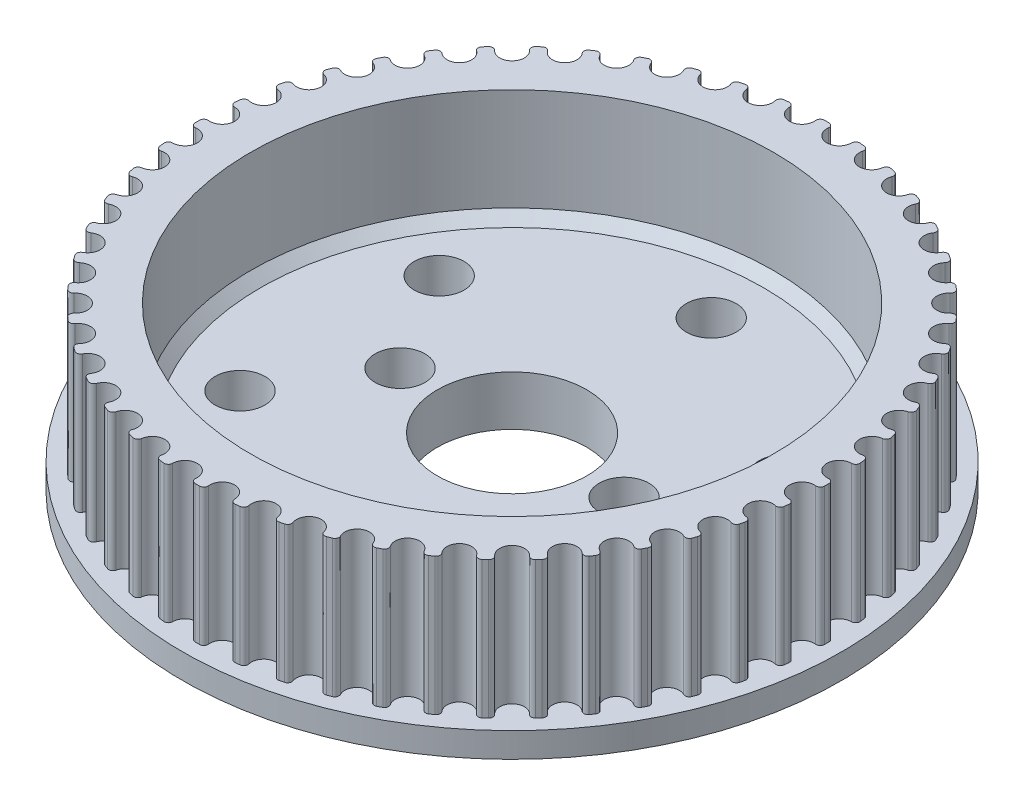
from build123d import *

# Parameters (mm, degrees)
BOSS_EXTRUDE1_DEPTH = 17.500000052
SKETCH2_R           = 33.3375
CUT_EXTRUDE1_DEPTH  = 60.384305584
SKETCH2_3_R         = 42.031336413
SKETCH2_3_R_2       = 9.525
BOSS_EXTRUDE2_DEPTH = 3.175
SKETCH2_4_R         = 33.3375
SKETCH2_4_R_2       = 9.525
BOSS_EXTRUDE3_DEPTH = 3.175
SKETCH3_R           = 3.175
CUT_EXTRUDE2_DEPTH  = 63.934268157
CHAMFER1_SIZE       = 1.27


with BuildPart() as part:
    # Sketch1 → Boss-Extrude1 (new body)
    with BuildSketch(Plane(origin=(0, 0, 0), x_dir=(1, 0, 0), z_dir=(0, 1, 0))):
        with BuildLine():
            ThreePointArc((39.528983097, 0.816020713), (37.771298771, 2.284742655), (39.339132732, 3.954621394))
            ThreePointArc((39.339132732, 3.954621394), (39.736181573, 4.133385986), (39.867708482, 4.548482641))
            ThreePointArc((39.867708482, 4.548482641), (39.850999917, 4.692619693), (39.833770242, 4.836695382))
            ThreePointArc((39.833770242, 4.836695382), (39.816019684, 4.980707824), (39.797748475, 5.124655137))
            ThreePointArc((39.797748475, 5.124655137), (39.570704367, 5.496213388), (39.142411877, 5.574763399))
            ThreePointArc((39.142411877, 5.574763399), (37.220508181, 6.820911271), (38.575629228, 8.667596215))
            ThreePointArc((38.575629228, 8.667596215), (38.948235445, 8.892916361), (39.028769002, 9.320840311))
            ThreePointArc((39.028769002, 9.320840311), (38.994808459, 9.461912447), (38.960338004, 9.602860854))
            ThreePointArc((38.960338004, 9.602860854), (38.925358085, 9.74368369), (38.889869162, 9.884379114))
            ThreePointArc((38.889869162, 9.884379114), (38.619694063, 10.225861144), (38.18505615, 10.252213482))
            ThreePointArc((38.18505615, 10.252213482), (36.126958769, 11.257615642), (37.249606185, 13.254177965))
            ThreePointArc((37.249606185, 13.254177965), (37.592336341, 13.52276799), (37.620702185, 13.957279141))
            ThreePointArc((37.620702185, 13.957279141), (37.569984886, 14.093229211), (37.518776306, 14.228994991))
            ThreePointArc((37.518776306, 14.228994991), (37.467077113, 14.364574707), (37.414887985, 14.499966586))
            ThreePointArc((37.414887985, 14.499966586), (37.105521656, 14.806392818), (36.67087632, 14.780163207))
            ThreePointArc((36.67087632, 14.780163207), (34.506596947, 15.530158627), (35.380400005, 17.647483956))
            ThreePointArc((35.380400005, 17.647483956), (35.688256322, 17.955427212), (35.664040816, 18.390189412))
            ThreePointArc((35.664040816, 18.390189412), (35.597306333, 18.519034958), (35.530106364, 18.64763834))
            ThreePointArc((35.530106364, 18.64763834), (35.462441788, 18.775997879), (35.39431349, 18.904111894))
            ThreePointArc((35.39431349, 18.904111894), (35.05026719, 19.171013943), (34.621952537, 19.09258487))
            ThreePointArc((34.621952537, 19.09258487), (32.38305124, 19.576236928), (32.995267924, 21.783449891))
            ThreePointArc((32.995267924, 21.783449891), (33.263761163, 22.126255873), (33.187317423, 22.55492931))
            ThreePointArc((33.187317423, 22.55492931), (33.105538896, 22.674791473), (33.023327465, 22.794357132))
            ThreePointArc((33.023327465, 22.794357132), (32.940684208, 22.913624721), (32.857610203, 23.032592682))
            ThreePointArc((32.857610203, 23.032592682), (32.483900901, 23.256078516), (32.068162725, 23.126593652))
            ThreePointArc((32.068162725, 23.126593652), (29.787287725, 23.336849613), (30.128990537, 25.601764075))
            ThreePointArc((30.128990537, 25.601764075), (30.354205463, 25.974433899), (30.226648211, 26.390767549))
            ThreePointArc((30.226648211, 26.390767549), (30.131018154, 26.499898471), (30.03499409, 26.608682868))
            ThreePointArc((30.03499409, 26.608682868), (29.938577275, 26.717119318), (29.841768971, 26.825206404))
            ThreePointArc((29.841768971, 26.825206404), (29.443846189, 27.002017096), (29.046746888, 26.823364623))
            ThreePointArc((29.046746888, 26.823364623), (26.75715848, 26.75715848), (26.823364623, 29.046746888))
            ThreePointArc((26.823364623, 29.046746888), (27.002017096, 29.443846189), (26.825206404, 29.841768971))
            ThreePointArc((26.825206404, 29.841768971), (26.717119318, 29.938577275), (26.608682868, 30.03499409))
            ThreePointArc((26.608682868, 30.03499409), (26.499898471, 30.131018154), (26.390767549, 30.226648211))
            ThreePointArc((26.390767549, 30.226648211), (25.974433899, 30.354205463), (25.601764075, 30.128990537))
            ThreePointArc((25.601764075, 30.128990537), (23.336849613, 29.787287725), (23.126593652, 32.068162725))
            ThreePointArc((23.126593652, 32.068162725), (23.256078516, 32.483900901), (23.032592682, 32.857610203))
            ThreePointArc((23.032592682, 32.857610203), (22.913624721, 32.940684208), (22.794357132, 33.023327465))
            ThreePointArc((22.794357132, 33.023327465), (22.674791473, 33.105538896), (22.55492931, 33.187317423))
            ThreePointArc((22.55492931, 33.187317423), (22.126255873, 33.263761163), (21.783449891, 32.995267924))
            ThreePointArc((21.783449891, 32.995267924), (19.576236928, 32.38305124), (19.09258487, 34.621952537))
            ThreePointArc((19.09258487, 34.621952537), (19.171013943, 35.05026719), (18.904111894, 35.39431349))
            ThreePointArc((18.904111894, 35.39431349), (18.775997879, 35.462441788), (18.64763834, 35.530106364))
            ThreePointArc((18.64763834, 35.530106364), (18.519034958, 35.597306333), (18.390189412, 35.664040816))
            ThreePointArc((18.390189412, 35.664040816), (17.955427212, 35.688256322), (17.647483956, 35.380400005))
            ThreePointArc((17.647483956, 35.380400005), (15.530158627, 34.506596947), (14.780163207, 36.67087632))
            ThreePointArc((14.780163207, 36.67087632), (14.806392818, 37.105521656), (14.499966586, 37.414887985))
            ThreePointArc((14.499966586, 37.414887985), (14.364574707, 37.467077113), (14.228994991, 37.518776306))
            ThreePointArc((14.228994991, 37.518776306), (14.093229211, 37.569984886), (13.957279141, 37.620702185))
            ThreePointArc((13.957279141, 37.620702185), (13.52276799, 37.592336341), (13.254177965, 37.249606185))
            ThreePointArc((13.254177965, 37.249606185), (11.257615642, 36.126958769), (10.252213482, 38.18505615))
            ThreePointArc((10.252213482, 38.18505615), (10.225861144, 38.619694063), (9.884379114, 38.889869162))
            ThreePointArc((9.884379114, 38.889869162), (9.74368369, 38.925358085), (9.602860854, 38.960338004))
            ThreePointArc((9.602860854, 38.960338004), (9.461912447, 38.994808459), (9.320840311, 39.028769002))
            ThreePointArc((9.320840311, 39.028769002), (8.892916361, 38.948235445), (8.667596215, 38.575629228))
            ThreePointArc((8.667596215, 38.575629228), (6.820911271, 37.220508181), (5.574763399, 39.142411877))
            ThreePointArc((5.574763399, 39.142411877), (5.496213388, 39.570704367), (5.124655137, 39.797748475))
            ThreePointArc((5.124655137, 39.797748475), (4.980707824, 39.816019684), (4.836695382, 39.833770242))
            ThreePointArc((4.836695382, 39.833770242), (4.692619693, 39.850999917), (4.548482641, 39.867708482))
            ThreePointArc((4.548482641, 39.867708482), (4.133385986, 39.736181573), (3.954621394, 39.339132732))
            ThreePointArc((3.954621394, 39.339132732), (2.284742655, 37.771298771), (0.816020713, 39.528983097))
            ThreePointArc((0.816020713, 39.528983097), (0.686418465, 39.944684695), (0.290202148, 40.125286998))
            ThreePointArc((0.290202148, 40.125286998), (0.145102023, 40.126074058), (0, 40.126336413))
            ThreePointArc((0, 40.126336413), (-0.145102023, 40.126074058), (-0.290202148, 40.125286998))
            ThreePointArc((-0.290202148, 40.125286998), (-0.686418465, 39.944684695), (-0.816020713, 39.528983097))
            ThreePointArc((-0.816020713, 39.528983097), (-2.284742655, 37.771298771), (-3.954621394, 39.339132732))
            ThreePointArc((-3.954621394, 39.339132732), (-4.133385986, 39.736181573), (-4.548482641, 39.867708482))
            ThreePointArc((-4.548482641, 39.867708482), (-4.692619693, 39.850999917), (-4.836695382, 39.833770242))
            ThreePointArc((-4.836695382, 39.833770242), (-4.980707824, 39.816019684), (-5.124655137, 39.797748475))
            ThreePointArc((-5.124655137, 39.797748475), (-5.496213388, 39.570704367), (-5.574763399, 39.142411877))
            ThreePointArc((-5.574763399, 39.142411877), (-6.820911271, 37.220508181), (-8.667596215, 38.575629228))
            ThreePointArc((-8.667596215, 38.575629228), (-8.892916361, 38.948235445), (-9.320840311, 39.028769002))
            ThreePointArc((-9.320840311, 39.028769002), (-9.461912447, 38.994808459), (-9.602860854, 38.960338004))
            ThreePointArc((-9.602860854, 38.960338004), (-9.74368369, 38.925358085), (-9.884379114, 38.889869162))
            ThreePointArc((-9.884379114, 38.889869162), (-10.225861144, 38.619694063), (-10.252213482, 38.18505615))
            ThreePointArc((-10.252213482, 38.18505615), (-11.257615642, 36.126958769), (-13.254177965, 37.249606185))
            ThreePointArc((-13.254177965, 37.249606185), (-13.52276799, 37.592336341), (-13.957279141, 37.620702185))
            ThreePointArc((-13.957279141, 37.620702185), (-14.093229211, 37.569984886), (-14.228994991, 37.518776306))
            ThreePointArc((-14.228994991, 37.518776306), (-14.364574707, 37.467077113), (-14.499966586, 37.414887985))
            ThreePointArc((-14.499966586, 37.414887985), (-14.806392818, 37.105521656), (-14.780163207, 36.67087632))
            ThreePointArc((-14.780163207, 36.67087632), (-15.530158627, 34.506596947), (-17.647483956, 35.380400005))
            ThreePointArc((-17.647483956, 35.380400005), (-17.955427212, 35.688256322), (-18.390189412, 35.664040816))
            ThreePointArc((-18.390189412, 35.664040816), (-18.519034958, 35.597306333), (-18.64763834, 35.530106364))
            ThreePointArc((-18.64763834, 35.530106364), (-18.775997879, 35.462441788), (-18.904111894, 35.39431349))
            ThreePointArc((-18.904111894, 35.39431349), (-19.171013943, 35.05026719), (-19.09258487, 34.621952537))
            ThreePointArc((-19.09258487, 34.621952537), (-19.576236928, 32.38305124), (-21.783449891, 32.995267924))
            ThreePointArc((-21.783449891, 32.995267924), (-22.126255873, 33.263761163), (-22.55492931, 33.187317423))
            ThreePointArc((-22.55492931, 33.187317423), (-22.674791473, 33.105538896), (-22.794357132, 33.023327465))
            ThreePointArc((-22.794357132, 33.023327465), (-22.913624721, 32.940684208), (-23.032592682, 32.857610203))
            ThreePointArc((-23.032592682, 32.857610203), (-23.256078516, 32.483900901), (-23.126593652, 32.068162725))
            ThreePointArc((-23.126593652, 32.068162725), (-23.336849613, 29.787287725), (-25.601764075, 30.128990537))
            ThreePointArc((-25.601764075, 30.128990537), (-25.974433899, 30.354205463), (-26.390767549, 30.226648211))
            ThreePointArc((-26.390767549, 30.226648211), (-26.499898471, 30.131018154), (-26.608682868, 30.03499409))
            ThreePointArc((-26.608682868, 30.03499409), (-26.717119318, 29.938577275), (-26.825206404, 29.841768971))
            ThreePointArc((-26.825206404, 29.841768971), (-27.002017096, 29.443846189), (-26.823364623, 29.046746888))
            ThreePointArc((-26.823364623, 29.046746888), (-26.75715848, 26.75715848), (-29.046746888, 26.823364623))
            ThreePointArc((-29.046746888, 26.823364623), (-29.443846189, 27.002017096), (-29.841768971, 26.825206404))
            ThreePointArc((-29.841768971, 26.825206404), (-29.938577275, 26.717119318), (-30.03499409, 26.608682868))
            ThreePointArc((-30.03499409, 26.608682868), (-30.131018154, 26.499898471), (-30.226648211, 26.390767549))
            ThreePointArc((-30.226648211, 26.390767549), (-30.354205463, 25.974433899), (-30.128990537, 25.601764075))
            ThreePointArc((-30.128990537, 25.601764075), (-29.787287725, 23.336849613), (-32.068162725, 23.126593652))
            ThreePointArc((-32.068162725, 23.126593652), (-32.483900901, 23.256078516), (-32.857610203, 23.032592682))
            ThreePointArc((-32.857610203, 23.032592682), (-32.940684208, 22.913624721), (-33.023327465, 22.794357132))
            ThreePointArc((-33.023327465, 22.794357132), (-33.105538896, 22.674791473), (-33.187317423, 22.55492931))
            ThreePointArc((-33.187317423, 22.55492931), (-33.263761163, 22.126255873), (-32.995267924, 21.783449891))
            ThreePointArc((-32.995267924, 21.783449891), (-32.38305124, 19.576236928), (-34.621952537, 19.09258487))
            ThreePointArc((-34.621952537, 19.09258487), (-35.05026719, 19.171013943), (-35.39431349, 18.904111894))
            ThreePointArc((-35.39431349, 18.904111894), (-35.462441788, 18.775997879), (-35.530106364, 18.64763834))
            ThreePointArc((-35.530106364, 18.64763834), (-35.597306333, 18.519034958), (-35.664040816, 18.390189412))
            ThreePointArc((-35.664040816, 18.390189412), (-35.688256322, 17.955427212), (-35.380400005, 17.647483956))
            ThreePointArc((-35.380400005, 17.647483956), (-34.506596947, 15.530158627), (-36.67087632, 14.780163207))
            ThreePointArc((-36.67087632, 14.780163207), (-37.105521656, 14.806392818), (-37.414887985, 14.499966586))
            ThreePointArc((-37.414887985, 14.499966586), (-37.467077113, 14.364574707), (-37.518776306, 14.228994991))
            ThreePointArc((-37.518776306, 14.228994991), (-37.569984886, 14.093229211), (-37.620702185, 13.957279141))
            ThreePointArc((-37.620702185, 13.957279141), (-37.592336341, 13.52276799), (-37.249606185, 13.254177965))
            ThreePointArc((-37.249606185, 13.254177965), (-36.126958769, 11.257615642), (-38.18505615, 10.252213482))
            ThreePointArc((-38.18505615, 10.252213482), (-38.619694063, 10.225861144), (-38.889869162, 9.884379114))
            ThreePointArc((-38.889869162, 9.884379114), (-38.925358085, 9.74368369), (-38.960338004, 9.602860854))
            ThreePointArc((-38.960338004, 9.602860854), (-38.994808459, 9.461912447), (-39.028769002, 9.320840311))
            ThreePointArc((-39.028769002, 9.320840311), (-38.948235445, 8.892916361), (-38.575629228, 8.667596215))
            ThreePointArc((-38.575629228, 8.667596215), (-37.220508181, 6.820911271), (-39.142411877, 5.574763399))
            ThreePointArc((-39.142411877, 5.574763399), (-39.570704367, 5.496213388), (-39.797748475, 5.124655137))
            ThreePointArc((-39.797748475, 5.124655137), (-39.816019684, 4.980707824), (-39.833770242, 4.836695382))
            ThreePointArc((-39.833770242, 4.836695382), (-39.850999917, 4.692619693), (-39.867708482, 4.548482641))
            ThreePointArc((-39.867708482, 4.548482641), (-39.736181573, 4.133385986), (-39.339132732, 3.954621394))
            ThreePointArc((-39.339132732, 3.954621394), (-37.771298771, 2.284742655), (-39.528983097, 0.816020713))
            ThreePointArc((-39.528983097, 0.816020713), (-39.944684695, 0.686418465), (-40.125286998, 0.290202148))
            ThreePointArc((-40.125286998, 0.290202148), (-40.126074058, 0.145102023), (-40.126336413, 0))
            ThreePointArc((-40.126336413, 0), (-40.126074058, -0.145102023), (-40.125286998, -0.290202148))
            ThreePointArc((-40.125286998, -0.290202148), (-39.944684695, -0.686418465), (-39.528983097, -0.816020713))
            ThreePointArc((-39.528983097, -0.816020713), (-37.771298771, -2.284742655), (-39.339132732, -3.954621394))
            ThreePointArc((-39.339132732, -3.954621394), (-39.736181573, -4.133385986), (-39.867708482, -4.548482641))
            ThreePointArc((-39.867708482, -4.548482641), (-39.850999917, -4.692619693), (-39.833770242, -4.836695382))
            ThreePointArc((-39.833770242, -4.836695382), (-39.816019684, -4.980707824), (-39.797748475, -5.124655137))
            ThreePointArc((-39.797748475, -5.124655137), (-39.570704367, -5.496213388), (-39.142411877, -5.574763399))
            ThreePointArc((-39.142411877, -5.574763399), (-37.220508181, -6.820911271), (-38.575629228, -8.667596215))
            ThreePointArc((-38.575629228, -8.667596215), (-38.948235445, -8.892916361), (-39.028769002, -9.320840311))
            ThreePointArc((-39.028769002, -9.320840311), (-38.994808459, -9.461912447), (-38.960338004, -9.602860854))
            ThreePointArc((-38.960338004, -9.602860854), (-38.925358085, -9.74368369), (-38.889869162, -9.884379114))
            ThreePointArc((-38.889869162, -9.884379114), (-38.619694063, -10.225861144), (-38.18505615, -10.252213482))
            ThreePointArc((-38.18505615, -10.252213482), (-36.126958769, -11.257615642), (-37.249606185, -13.254177965))
            ThreePointArc((-37.249606185, -13.254177965), (-37.592336341, -13.52276799), (-37.620702185, -13.957279141))
            ThreePointArc((-37.620702185, -13.957279141), (-37.569984886, -14.093229211), (-37.518776306, -14.228994991))
            ThreePointArc((-37.518776306, -14.228994991), (-37.467077113, -14.364574707), (-37.414887985, -14.499966586))
            ThreePointArc((-37.414887985, -14.499966586), (-37.105521656, -14.806392818), (-36.67087632, -14.780163207))
            ThreePointArc((-36.67087632, -14.780163207), (-34.506596947, -15.530158627), (-35.380400005, -17.647483956))
            ThreePointArc((-35.380400005, -17.647483956), (-35.688256322, -17.955427212), (-35.664040816, -18.390189412))
            ThreePointArc((-35.664040816, -18.390189412), (-35.597306333, -18.519034958), (-35.530106364, -18.64763834))
            ThreePointArc((-35.530106364, -18.64763834), (-35.462441788, -18.775997879), (-35.39431349, -18.904111894))
            ThreePointArc((-35.39431349, -18.904111894), (-35.05026719, -19.171013943), (-34.621952537, -19.09258487))
            ThreePointArc((-34.621952537, -19.09258487), (-32.38305124, -19.576236928), (-32.995267924, -21.783449891))
            ThreePointArc((-32.995267924, -21.783449891), (-33.263761163, -22.126255873), (-33.187317423, -22.55492931))
            ThreePointArc((-33.187317423, -22.55492931), (-33.105538896, -22.674791473), (-33.023327465, -22.794357132))
            ThreePointArc((-33.023327465, -22.794357132), (-32.940684208, -22.913624721), (-32.857610203, -23.032592682))
            ThreePointArc((-32.857610203, -23.032592682), (-32.483900901, -23.256078516), (-32.068162725, -23.126593652))
            ThreePointArc((-32.068162725, -23.126593652), (-29.787287725, -23.336849613), (-30.128990537, -25.601764075))
            ThreePointArc((-30.128990537, -25.601764075), (-30.354205463, -25.974433899), (-30.226648211, -26.390767549))
            ThreePointArc((-30.226648211, -26.390767549), (-30.131018154, -26.499898471), (-30.03499409, -26.608682868))
            ThreePointArc((-30.03499409, -26.608682868), (-29.938577275, -26.717119318), (-29.841768971, -26.825206404))
            ThreePointArc((-29.841768971, -26.825206404), (-29.443846189, -27.002017096), (-29.046746888, -26.823364623))
            ThreePointArc((-29.046746888, -26.823364623), (-26.75715848, -26.75715848), (-26.823364623, -29.046746888))
            ThreePointArc((-26.823364623, -29.046746888), (-27.002017096, -29.443846189), (-26.825206404, -29.841768971))
            ThreePointArc((-26.825206404, -29.841768971), (-26.717119318, -29.938577275), (-26.608682868, -30.03499409))
            ThreePointArc((-26.608682868, -30.03499409), (-26.499898471, -30.131018154), (-26.390767549, -30.226648211))
            ThreePointArc((-26.390767549, -30.226648211), (-25.974433899, -30.354205463), (-25.601764075, -30.128990537))
            ThreePointArc((-25.601764075, -30.128990537), (-23.336849613, -29.787287725), (-23.126593652, -32.068162725))
            ThreePointArc((-23.126593652, -32.068162725), (-23.256078516, -32.483900901), (-23.032592682, -32.857610203))
            ThreePointArc((-23.032592682, -32.857610203), (-22.913624721, -32.940684208), (-22.794357132, -33.023327465))
            ThreePointArc((-22.794357132, -33.023327465), (-22.674791473, -33.105538896), (-22.55492931, -33.187317423))
            ThreePointArc((-22.55492931, -33.187317423), (-22.126255873, -33.263761163), (-21.783449891, -32.995267924))
            ThreePointArc((-21.783449891, -32.995267924), (-19.576236928, -32.38305124), (-19.09258487, -34.621952537))
            ThreePointArc((-19.09258487, -34.621952537), (-19.171013943, -35.05026719), (-18.904111894, -35.39431349))
            ThreePointArc((-18.904111894, -35.39431349), (-18.775997879, -35.462441788), (-18.64763834, -35.530106364))
            ThreePointArc((-18.64763834, -35.530106364), (-18.519034958, -35.597306333), (-18.390189412, -35.664040816))
            ThreePointArc((-18.390189412, -35.664040816), (-17.955427212, -35.688256322), (-17.647483956, -35.380400005))
            ThreePointArc((-17.647483956, -35.380400005), (-15.530158627, -34.506596947), (-14.780163207, -36.67087632))
            ThreePointArc((-14.780163207, -36.67087632), (-14.806392818, -37.105521656), (-14.499966586, -37.414887985))
            ThreePointArc((-14.499966586, -37.414887985), (-14.364574707, -37.467077113), (-14.228994991, -37.518776306))
            ThreePointArc((-14.228994991, -37.518776306), (-14.093229211, -37.569984886), (-13.957279141, -37.620702185))
            ThreePointArc((-13.957279141, -37.620702185), (-13.52276799, -37.592336341), (-13.254177965, -37.249606185))
            ThreePointArc((-13.254177965, -37.249606185), (-11.257615642, -36.126958769), (-10.252213482, -38.18505615))
            ThreePointArc((-10.252213482, -38.18505615), (-10.225861144, -38.619694063), (-9.884379114, -38.889869162))
            ThreePointArc((-9.884379114, -38.889869162), (-9.74368369, -38.925358085), (-9.602860854, -38.960338004))
            ThreePointArc((-9.602860854, -38.960338004), (-9.461912447, -38.994808459), (-9.320840311, -39.028769002))
            ThreePointArc((-9.320840311, -39.028769002), (-8.892916361, -38.948235445), (-8.667596215, -38.575629228))
            ThreePointArc((-8.667596215, -38.575629228), (-6.820911271, -37.220508181), (-5.574763399, -39.142411877))
            ThreePointArc((-5.574763399, -39.142411877), (-5.496213388, -39.570704367), (-5.124655137, -39.797748475))
            ThreePointArc((-5.124655137, -39.797748475), (-4.980707824, -39.816019684), (-4.836695382, -39.833770242))
            ThreePointArc((-4.836695382, -39.833770242), (-4.692619693, -39.850999917), (-4.548482641, -39.867708482))
            ThreePointArc((-4.548482641, -39.867708482), (-4.133385986, -39.736181573), (-3.954621394, -39.339132732))
            ThreePointArc((-3.954621394, -39.339132732), (-2.284742655, -37.771298771), (-0.816020713, -39.528983097))
            ThreePointArc((-0.816020713, -39.528983097), (-0.686418465, -39.944684695), (-0.290202148, -40.125286998))
            ThreePointArc((-0.290202148, -40.125286998), (-0.145102023, -40.126074058), (0, -40.126336413))
            ThreePointArc((0, -40.126336413), (0.145102023, -40.126074058), (0.290202148, -40.125286998))
            ThreePointArc((0.290202148, -40.125286998), (0.686418465, -39.944684695), (0.816020713, -39.528983097))
            ThreePointArc((0.816020713, -39.528983097), (2.284742655, -37.771298771), (3.954621394, -39.339132732))
            ThreePointArc((3.954621394, -39.339132732), (4.133385986, -39.736181573), (4.548482641, -39.867708482))
            ThreePointArc((4.548482641, -39.867708482), (4.692619693, -39.850999917), (4.836695382, -39.833770242))
            ThreePointArc((4.836695382, -39.833770242), (4.980707824, -39.816019684), (5.124655137, -39.797748475))
            ThreePointArc((5.124655137, -39.797748475), (5.496213388, -39.570704367), (5.574763399, -39.142411877))
            ThreePointArc((5.574763399, -39.142411877), (6.820911271, -37.220508181), (8.667596215, -38.575629228))
            ThreePointArc((8.667596215, -38.575629228), (8.892916361, -38.948235445), (9.320840311, -39.028769002))
            ThreePointArc((9.320840311, -39.028769002), (9.461912447, -38.994808459), (9.602860854, -38.960338004))
            ThreePointArc((9.602860854, -38.960338004), (9.74368369, -38.925358085), (9.884379114, -38.889869162))
            ThreePointArc((9.884379114, -38.889869162), (10.225861144, -38.619694063), (10.252213482, -38.18505615))
            ThreePointArc((10.252213482, -38.18505615), (11.257615642, -36.126958769), (13.254177965, -37.249606185))
            ThreePointArc((13.254177965, -37.249606185), (13.52276799, -37.592336341), (13.957279141, -37.620702185))
            ThreePointArc((13.957279141, -37.620702185), (14.093229211, -37.569984886), (14.228994991, -37.518776306))
            ThreePointArc((14.228994991, -37.518776306), (14.364574707, -37.467077113), (14.499966586, -37.414887985))
            ThreePointArc((14.499966586, -37.414887985), (14.806392818, -37.105521656), (14.780163207, -36.67087632))
            ThreePointArc((14.780163207, -36.67087632), (15.530158627, -34.506596947), (17.647483956, -35.380400005))
            ThreePointArc((17.647483956, -35.380400005), (17.955427212, -35.688256322), (18.390189412, -35.664040816))
            ThreePointArc((18.390189412, -35.664040816), (18.519034958, -35.597306333), (18.64763834, -35.530106364))
            ThreePointArc((18.64763834, -35.530106364), (18.775997879, -35.462441788), (18.904111894, -35.39431349))
            ThreePointArc((18.904111894, -35.39431349), (19.171013943, -35.05026719), (19.09258487, -34.621952537))
            ThreePointArc((19.09258487, -34.621952537), (19.576236928, -32.38305124), (21.783449891, -32.995267924))
            ThreePointArc((21.783449891, -32.995267924), (22.126255873, -33.263761163), (22.55492931, -33.187317423))
            ThreePointArc((22.55492931, -33.187317423), (22.674791473, -33.105538896), (22.794357132, -33.023327465))
            ThreePointArc((22.794357132, -33.023327465), (22.913624721, -32.940684208), (23.032592682, -32.857610203))
            ThreePointArc((23.032592682, -32.857610203), (23.256078516, -32.483900901), (23.126593652, -32.068162725))
            ThreePointArc((23.126593652, -32.068162725), (23.336849613, -29.787287725), (25.601764075, -30.128990537))
            ThreePointArc((25.601764075, -30.128990537), (25.974433899, -30.354205463), (26.390767549, -30.226648211))
            ThreePointArc((26.390767549, -30.226648211), (26.499898471, -30.131018154), (26.608682868, -30.03499409))
            ThreePointArc((26.608682868, -30.03499409), (26.717119318, -29.938577275), (26.825206404, -29.841768971))
            ThreePointArc((26.825206404, -29.841768971), (27.002017096, -29.443846189), (26.823364623, -29.046746888))
            ThreePointArc((26.823364623, -29.046746888), (26.75715848, -26.75715848), (29.046746888, -26.823364623))
            ThreePointArc((29.046746888, -26.823364623), (29.443846189, -27.002017096), (29.841768971, -26.825206404))
            ThreePointArc((29.841768971, -26.825206404), (29.938577275, -26.717119318), (30.03499409, -26.608682868))
            ThreePointArc((30.03499409, -26.608682868), (30.131018154, -26.499898471), (30.226648211, -26.390767549))
            ThreePointArc((30.226648211, -26.390767549), (30.354205463, -25.974433899), (30.128990537, -25.601764075))
            ThreePointArc((30.128990537, -25.601764075), (29.787287725, -23.336849613), (32.068162725, -23.126593652))
            ThreePointArc((32.068162725, -23.126593652), (32.483900901, -23.256078516), (32.857610203, -23.032592682))
            ThreePointArc((32.857610203, -23.032592682), (32.940684208, -22.913624721), (33.023327465, -22.794357132))
            ThreePointArc((33.023327465, -22.794357132), (33.105538896, -22.674791473), (33.187317423, -22.55492931))
            ThreePointArc((33.187317423, -22.55492931), (33.263761163, -22.126255873), (32.995267924, -21.783449891))
            ThreePointArc((32.995267924, -21.783449891), (32.38305124, -19.576236928), (34.621952537, -19.09258487))
            ThreePointArc((34.621952537, -19.09258487), (35.05026719, -19.171013943), (35.39431349, -18.904111894))
            ThreePointArc((35.39431349, -18.904111894), (35.462441788, -18.775997879), (35.530106364, -18.64763834))
            ThreePointArc((35.530106364, -18.64763834), (35.597306333, -18.519034958), (35.664040816, -18.390189412))
            ThreePointArc((35.664040816, -18.390189412), (35.688256322, -17.955427212), (35.380400005, -17.647483956))
            ThreePointArc((35.380400005, -17.647483956), (34.506596947, -15.530158627), (36.67087632, -14.780163207))
            ThreePointArc((36.67087632, -14.780163207), (37.105521656, -14.806392818), (37.414887985, -14.499966586))
            ThreePointArc((37.414887985, -14.499966586), (37.467077113, -14.364574707), (37.518776306, -14.228994991))
            ThreePointArc((37.518776306, -14.228994991), (37.569984886, -14.093229211), (37.620702185, -13.957279141))
            ThreePointArc((37.620702185, -13.957279141), (37.592336341, -13.52276799), (37.249606185, -13.254177965))
            ThreePointArc((37.249606185, -13.254177965), (36.126958769, -11.257615642), (38.18505615, -10.252213482))
            ThreePointArc((38.18505615, -10.252213482), (38.619694063, -10.225861144), (38.889869162, -9.884379114))
            ThreePointArc((38.889869162, -9.884379114), (38.925358085, -9.74368369), (38.960338004, -9.602860854))
            ThreePointArc((38.960338004, -9.602860854), (38.994808459, -9.461912447), (39.028769002, -9.320840311))
            ThreePointArc((39.028769002, -9.320840311), (38.948235445, -8.892916361), (38.575629228, -8.667596215))
            ThreePointArc((38.575629228, -8.667596215), (37.220508181, -6.820911271), (39.142411877, -5.574763399))
            ThreePointArc((39.142411877, -5.574763399), (39.570704367, -5.496213388), (39.797748475, -5.124655137))
            ThreePointArc((39.797748475, -5.124655137), (39.816019684, -4.980707824), (39.833770242, -4.836695382))
            ThreePointArc((39.833770242, -4.836695382), (39.850999917, -4.692619693), (39.867708482, -4.548482641))
            ThreePointArc((39.867708482, -4.548482641), (39.736181573, -4.133385986), (39.339132732, -3.954621394))
            ThreePointArc((39.339132732, -3.954621394), (37.771298771, -2.284742655), (39.528983097, -0.816020713))
            ThreePointArc((39.528983097, -0.816020713), (39.944684695, -0.686418465), (40.125286998, -0.290202148))
            ThreePointArc((40.125286998, -0.290202148), (40.126074058, -0.145102023), (40.126336413, 0))
            ThreePointArc((40.126336413, 0), (40.126074058, 0.145102023), (40.125286998, 0.290202148))
            ThreePointArc((40.125286998, 0.290202148), (39.944684695, 0.686418465), (39.528983097, 0.816020713))
        make_face()
    extrude(amount=BOSS_EXTRUDE1_DEPTH)

    # Sketch2 → Cut-Extrude1 (cut, through all)
    with BuildSketch(Plane.XZ):
        Circle(SKETCH2_R)
    extrude(amount=-CUT_EXTRUDE1_DEPTH, mode=Mode.SUBTRACT)

    # Sketch2<3> → Boss-Extrude2 (add)
    with BuildSketch(Plane.XZ):
        Circle(SKETCH2_3_R)
        Circle(SKETCH2_3_R_2, mode=Mode.SUBTRACT)
    extrude(amount=BOSS_EXTRUDE2_DEPTH)

    # Sketch2<4> → Boss-Extrude3 (add)
    with BuildSketch(Plane.XZ):
        Circle(SKETCH2_4_R)
        Circle(SKETCH2_4_R_2, mode=Mode.SUBTRACT)
    extrude(amount=-BOSS_EXTRUDE3_DEPTH)

    # Sketch3 → Cut-Extrude2 (cut, through all)
    with BuildSketch(Plane.XZ.offset(3.175)):
        with Locations((21.997045256, 12.7)):
            Circle(SKETCH3_R)
        with Locations((0, 25.4)):
            Circle(SKETCH3_R)
        with Locations((21.997045256, -12.7)):
            Circle(SKETCH3_R)
        with Locations((0, -25.4)):
            Circle(SKETCH3_R)
        with Locations((-21.997045256, 12.7)):
            Circle(SKETCH3_R)
        with Locations((-21.997045256, -12.7)):
            Circle(SKETCH3_R)
        with Locations((14.2875, 0)):
            Circle(SKETCH3_R)
        with Locations((-14.2875, 0)):
            Circle(SKETCH3_R)
    extrude(amount=-CUT_EXTRUDE2_DEPTH, mode=Mode.SUBTRACT)

    # Chamfer1
    chamfer1_edges = [part.edges().sort_by_distance(p)[0] for p in [
        (-33.3375, 3.175, 0),
    ]]
    chamfer(chamfer1_edges, length=CHAMFER1_SIZE)


solid = part.part
